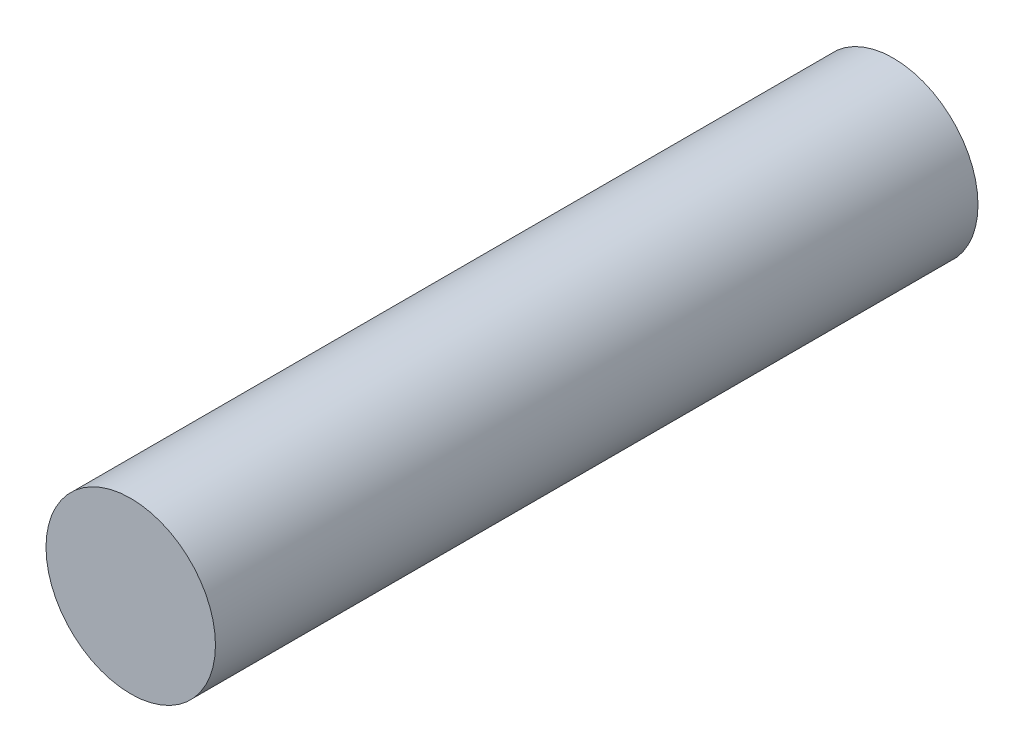
from build123d import *

# Parameters (mm, degrees)
SKETCH1_R           = 12.7
BOSS_EXTRUDE1_DEPTH = 114.3


with BuildPart() as part:
    # Sketch1 → Boss-Extrude1 (new body)
    with BuildSketch(Plane.XY):
        Circle(SKETCH1_R)
    extrude(amount=BOSS_EXTRUDE1_DEPTH)


solid = part.part
